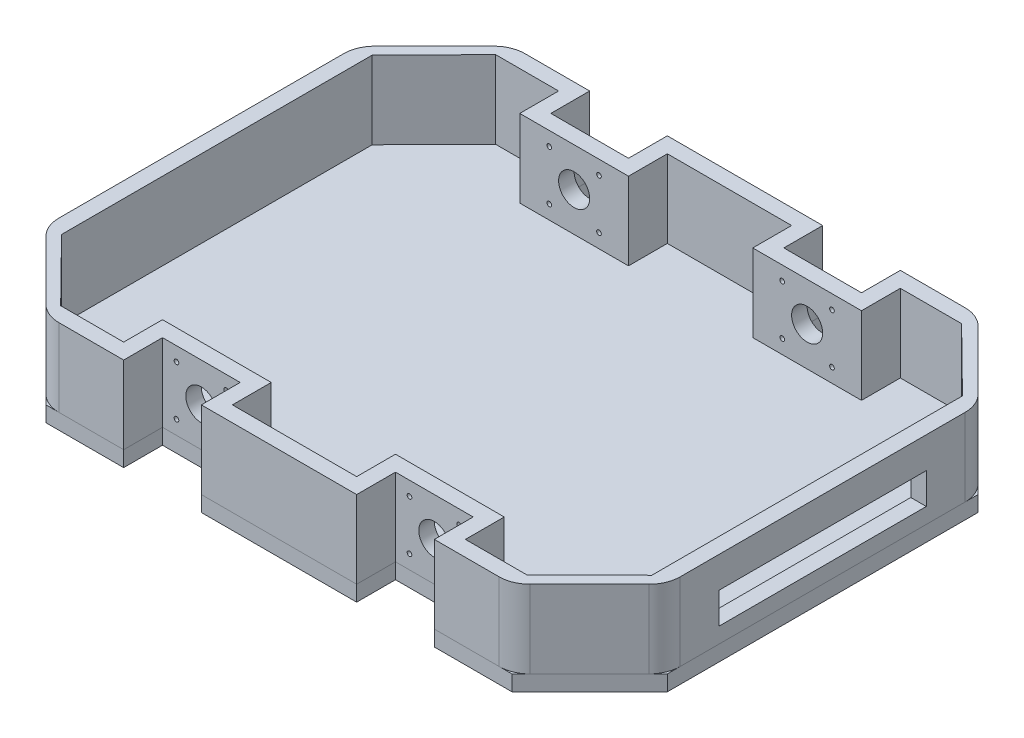
from build123d import *

# Parameters (mm, degrees)
BOSS_EXTRUDE2_DEPTH = 50
BOSS_EXTRUDE4_DEPTH = 10
SKETCH6_R           = 10
SKETCH6_R_2         = 1.5
CUT_EXTRUDE3_DEPTH  = 427.86744359
SKETCH8_R           = 10
SKETCH8_R_2         = 1.5
CUT_EXTRUDE4_DEPTH  = 427.86744359
FILLET2_R           = 20
SKETCH9_W           = 133.431457505
SKETCH9_H           = 20
CUT_EXTRUDE5_DEPTH  = 10


with BuildPart() as part:
    # Sketch1 → Boss-Extrude2 (new body)
    with BuildSketch(Plane(origin=(0, 0, 0), x_dir=(1, 0, 0), z_dir=(0, 1, 0))):
        Polygon((-272.631080953, -209.723132334), (-322.631080953, -159.723132334), (-322.631080953, 40.276867666), (-272.631080953, 90.276867666), (-222.631080953, 90.276867666), (-222.631080953, 65.276867666), (-172.631080953, 65.276867666), (-172.631080953, 90.276867666), (-72.631080953, 90.276867666), (-72.631080953, 65.276867666), (-22.631080953, 65.276867666), (-22.631080953, 90.276867666), (27.368919047, 90.276867666), (77.368919047, 40.276867666), (77.368919047, -159.723132334), (27.368919047, -209.723132334), (-22.631080953, -209.723132334), (-22.631080953, -184.723132334), (-72.631080953, -184.723132334), (-72.631080953, -209.723132334), (-172.631080953, -209.723132334), (-172.631080953, -184.723132334), (-222.631080953, -184.723132334), (-222.631080953, -209.723132334), align=None)
        Polygon((-312.631080953, -159.723132334), (-273.194558937, -199.723132334), (-232.631080953, -199.723132334), (-232.631080953, -174.723132334), (-162.631080953, -174.723132334), (-162.631080953, -199.723132334), (-82.631080953, -199.723132334), (-82.631080953, -174.723132334), (-12.631080953, -174.723132334), (-12.631080953, -199.723132334), (26.797389961, -199.723132334), (67.368919047, -159.723132334), (67.368919047, 40.276867666), (26.797389961, 80.276867666), (-12.631080953, 80.276867666), (-12.631080953, 55.276867666), (-82.631080953, 55.276867666), (-82.631080953, 80.276867666), (-162.631080953, 80.276867666), (-162.631080953, 55.276867666), (-232.631080953, 55.276867666), (-232.631080953, 80.276867666), (-273.194558937, 80.276867666), (-312.631080953, 40.276867666), align=None, mode=Mode.SUBTRACT)
    extrude(amount=BOSS_EXTRUDE2_DEPTH)

    # Sketch6 → Cut-Extrude3 (cut, through all)
    with BuildSketch(Plane.XY.offset(184.723132334)):
        with Locations((-47.631080953, 25)):
            Circle(SKETCH6_R)
        with Locations((-31.631080953, 41)):
            Circle(SKETCH6_R_2)
        with Locations((-63.631080953, 41)):
            Circle(SKETCH6_R_2)
        with Locations((-63.631080953, 9)):
            Circle(SKETCH6_R_2)
        with Locations((-31.631080953, 9)):
            Circle(SKETCH6_R_2)
    extrude(amount=-CUT_EXTRUDE3_DEPTH, mode=Mode.SUBTRACT)

    # Sketch8 → Cut-Extrude4 (cut, through all)
    with BuildSketch(Plane.XY.offset(184.723132334)):
        with Locations((-197.631080953, 25)):
            Circle(SKETCH8_R)
        with Locations((-181.631080953, 41)):
            Circle(SKETCH8_R_2)
        with Locations((-213.631080953, 41)):
            Circle(SKETCH8_R_2)
        with Locations((-213.631080953, 9)):
            Circle(SKETCH8_R_2)
        with Locations((-181.631080953, 9)):
            Circle(SKETCH8_R_2)
    extrude(amount=-CUT_EXTRUDE4_DEPTH, mode=Mode.SUBTRACT)

    # Fillet2
    fillet2_edges = [part.edges().sort_by_distance(p)[0] for p in [
        (-322.631080953, 25, 159.723132334),
        (-322.631080953, 25, -40.276867666),
        (-272.631080953, 25, -90.276867666),
        (27.368919047, 25, -90.276867666),
        (77.368919047, 25, -40.276867666),
        (77.368919047, 25, 159.723132334),
        (27.368919047, 25, 209.723132334),
        (-272.631080953, 25, 209.723132334),
    ]]
    fillet(fillet2_edges, radius=FILLET2_R)

    # Sketch9 → Cut-Extrude5 (cut)
    with BuildSketch(Plane(origin=(77.368919047, 0, 0), x_dir=(0, 0, -1), z_dir=(1, 0, 0))):
        with Locations((-59.723132334, 20)):
            Rectangle(SKETCH9_W, SKETCH9_H)
    extrude(amount=-CUT_EXTRUDE5_DEPTH, mode=Mode.SUBTRACT)


with BuildPart() as body_2:
    # Sketch5 → Boss-Extrude4 (new body)
    with BuildSketch(Plane(origin=(0, 0, 0), x_dir=(1, 0, 0), z_dir=(0, 1, 0))):
        Polygon((-322.631080953, 40.276867666), (-322.631080953, -159.723132334), (-272.631080953, -209.723132334), (-222.631080953, -209.723132334), (-222.631080953, -184.723132334), (-172.631080953, -184.723132334), (-172.631080953, -209.723132334), (-72.631080953, -209.723132334), (-72.631080953, -184.723132334), (-22.631080953, -184.723132334), (-22.631080953, -209.723132334), (27.368919047, -209.723132334), (77.368919047, -159.723132334), (77.368919047, 40.276867666), (27.368919047, 90.276867666), (-22.631080953, 90.276867666), (-22.631080953, 65.276867666), (-72.631080953, 65.276867666), (-72.631080953, 90.276867666), (-172.631080953, 90.276867666), (-172.631080953, 65.276867666), (-222.631080953, 65.276867666), (-222.631080953, 90.276867666), (-272.631080953, 90.276867666), align=None)
    extrude(amount=-BOSS_EXTRUDE4_DEPTH)


solid = Compound([part.part, body_2.part])
